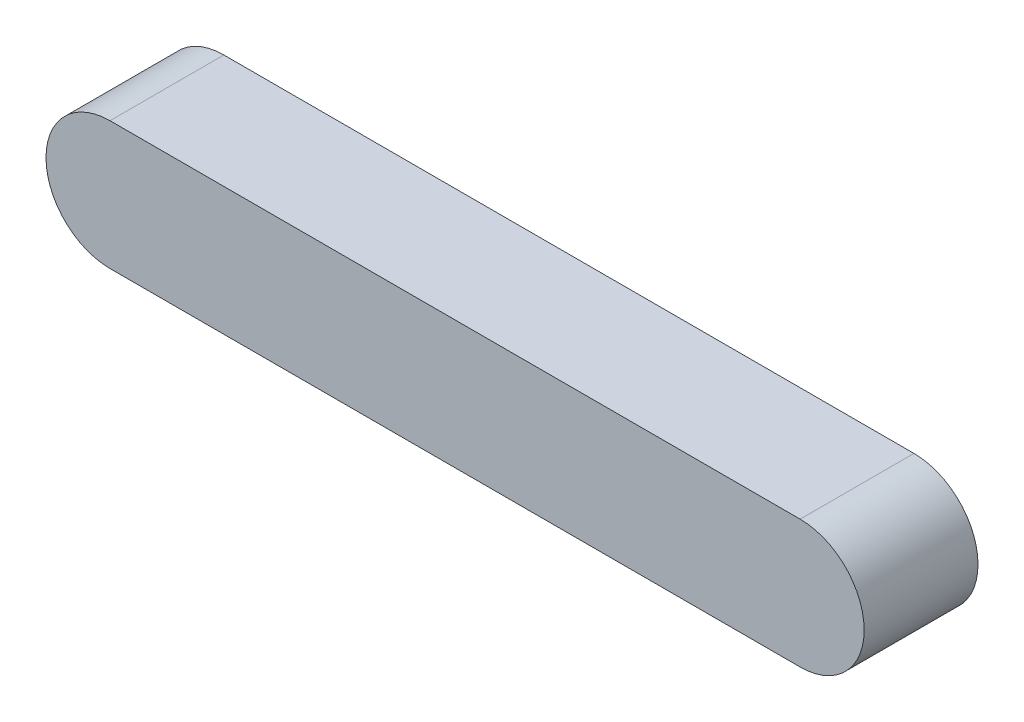
from build123d import *

# Parameters (mm, degrees)
BOSS_EXTRUDE1_DEPTH = 16


with BuildPart() as part:
    # Sketch1 → Boss-Extrude1 (new body)
    with BuildSketch(Plane.XY):
        with BuildLine():
            Line((-48.5, 9), (48.5, 9))
            ThreePointArc((48.5, 9), (57.5, 0), (48.5, -9))
            Line((48.5, -9), (-48.5, -9))
            ThreePointArc((-48.5, -9), (-57.5, 0), (-48.5, 9))
        make_face()
    extrude(amount=BOSS_EXTRUDE1_DEPTH)


solid = part.part
